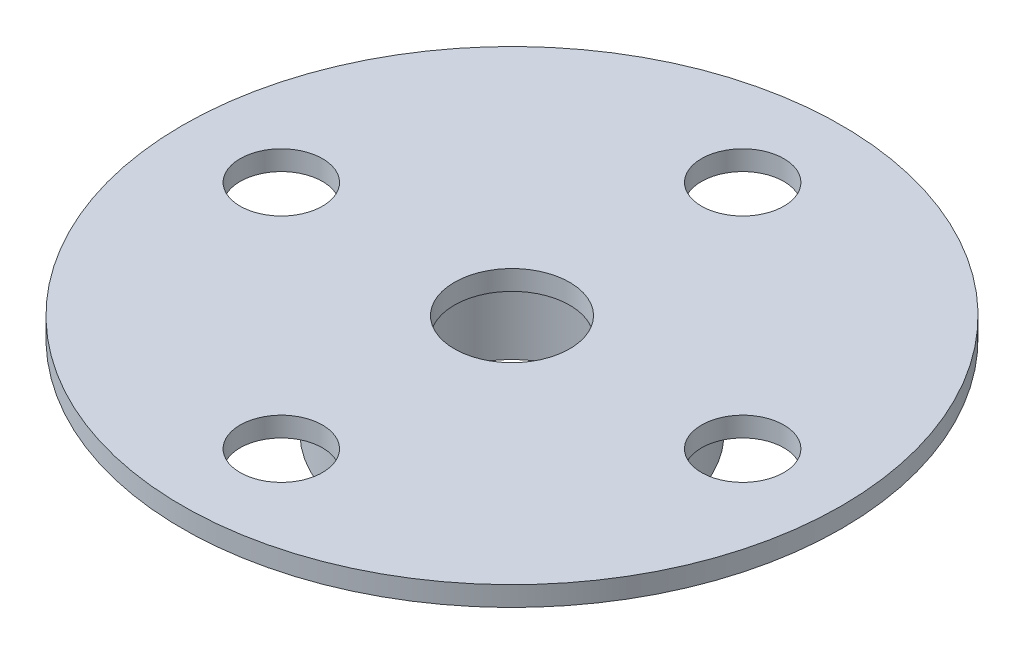
from build123d import *

# Parameters (mm, degrees)
SKETCH3_R          = 1.25
CUT_EXTRUDE1_DEPTH = 15.477914214


with BuildPart() as part:
    # Sketch2 → Revolve1 (revolve)
    with BuildSketch(Plane.XY, mode=Mode.PRIVATE) as revolve1_sk:
        Polygon((1.75, 0), (10, 0), (10, -0.6), (4.55, -0.6), (4.55, -3.1), (2.75, -3.1), (2.75, -0.6), (1.75, -0.6), align=None)
    revolve(revolve1_sk.sketch.rotate(Axis((0, 0, 0), (0, -1, 0)), 180), axis=Axis((0, 0, 0), (0, -1, 0)))

    # Sketch3 → Cut-Extrude1 (cut, through all)
    with BuildSketch(Plane(origin=(0, 0, 0), x_dir=(1, 0, 0), z_dir=(0, 1, 0))):
        with Locations(Location((0, 7, 0), (0, 0, 180))):
            Circle(SKETCH3_R)
        with Locations(Location((7, 0, 0), (0, 0, 180))):
            Circle(SKETCH3_R)
        with Locations(Location((0, -7, 0), (0, 0, 180))):
            Circle(SKETCH3_R)
        with Locations(Location((-7, 0, 0), (0, 0, 180))):
            Circle(SKETCH3_R)
    extrude(amount=-CUT_EXTRUDE1_DEPTH, mode=Mode.SUBTRACT)


solid = part.part
